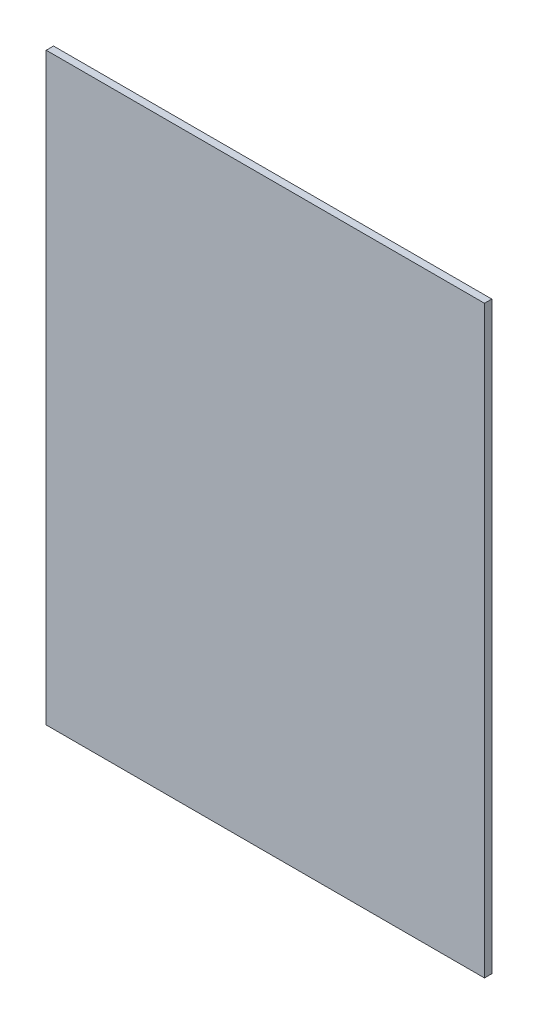
from build123d import *

# Parameters (mm, degrees)
SKETCH1_W           = 304.8
SKETCH1_H           = 406.4
BOSS_EXTRUDE1_DEPTH = 5.08


with BuildPart() as part:
    # Sketch1 → Boss-Extrude1 (new body)
    with BuildSketch(Plane.XY):
        with Locations((152.4, 203.2)):
            Rectangle(SKETCH1_W, SKETCH1_H)
    extrude(amount=BOSS_EXTRUDE1_DEPTH)


solid = part.part
